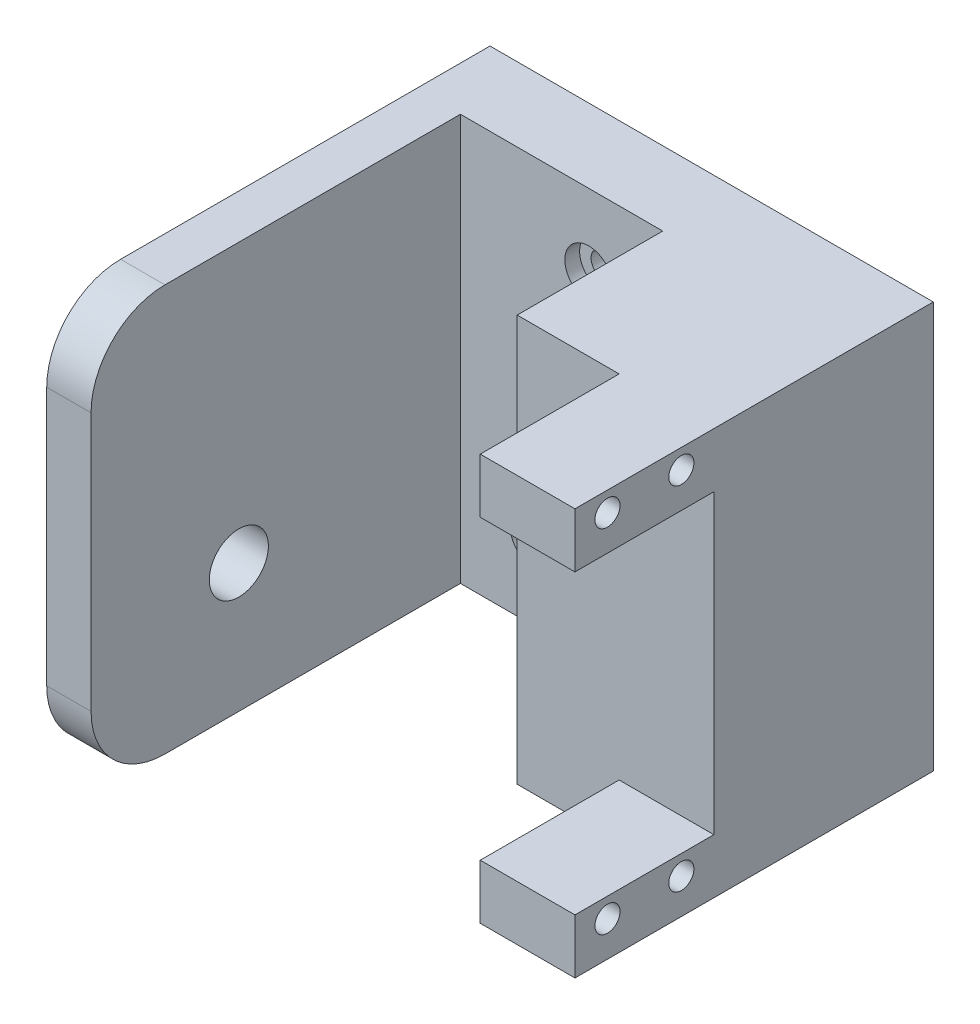
from build123d import *

# Parameters (mm, degrees)
ESQUISSE1_W                                          = 60
ESQUISSE1_H                                          = 55
BOSS_EXTRU_1_DEPTH                                   = 10
ESQUISSE2_W                                          = 6
ESQUISSE2_H                                          = 55
BOSS_EXTRU_2_DEPTH                                   = 50
ESQUISSE3_W                                          = 26.62
ESQUISSE3_H                                          = 55
BOSS_EXTRU_3_DEPTH                                   = 19.7
CHAMBRAGE_POUR_T_TE_CYLINDRIQUE_FENDUE_M_D           = 3.4
CHAMBRAGE_POUR_T_TE_CYLINDRIQUE_FENDUE_M_DEPTH       = 10
CHAMBRAGE_POUR_T_TE_CYLINDRIQUE_FENDUE_M_CBORE_D     = 6.5
CHAMBRAGE_POUR_T_TE_CYLINDRIQUE_FENDUE_M_CBORE_DEPTH = 2
CHAMBRAGE_POUR_T_TE_CYLINDRIQUE_FENDUE_M_TIP         = 1.021463052
CONG_1_R                                             = 10
ESQUISSE8_R                                          = 4
ENL_V_MAT_EXTRU_2_DEPTH                              = 6
ESQUISSE12_W                                         = 12.82
ESQUISSE12_H                                         = 7.4
BOSS_EXTRU_4_DEPTH                                   = 18.8
D_GAGEMENT_M32_D                                     = 3.4
D_GAGEMENT_M32_DEPTH                                 = 12.82
D_GAGEMENT_M32_TIP                                   = 1.021463052


with BuildPart() as part:
    # Esquisse1 → Boss.-Extru.1 (new body)
    with BuildSketch(Plane.XY):
        with Locations((30, 27.5)):
            Rectangle(ESQUISSE1_W, ESQUISSE1_H)
    extrude(amount=BOSS_EXTRU_1_DEPTH)

    # Esquisse2 → Boss.-Extru.2 (add)
    with BuildSketch(Plane.XY.offset(10)):
        with Locations((3, 27.5)):
            Rectangle(ESQUISSE2_W, ESQUISSE2_H)
    extrude(amount=BOSS_EXTRU_2_DEPTH)

    # Esquisse3 → Boss.-Extru.3 (add)
    with BuildSketch(Plane.XY.offset(10)):
        with Locations((46.69, 27.5)):
            Rectangle(ESQUISSE3_W, ESQUISSE3_H)
    extrude(amount=BOSS_EXTRU_3_DEPTH)

    # Chambrage pour tête cylindrique fendue M31
    with Locations(Plane.XY.offset(10)):
        with Locations((23.38, 45), (16, 10)):
            CounterBoreHole(CHAMBRAGE_POUR_T_TE_CYLINDRIQUE_FENDUE_M_D / 2, CHAMBRAGE_POUR_T_TE_CYLINDRIQUE_FENDUE_M_CBORE_D / 2, CHAMBRAGE_POUR_T_TE_CYLINDRIQUE_FENDUE_M_CBORE_DEPTH, depth=CHAMBRAGE_POUR_T_TE_CYLINDRIQUE_FENDUE_M_DEPTH)
            with Locations((0, 0, -(CHAMBRAGE_POUR_T_TE_CYLINDRIQUE_FENDUE_M_DEPTH + CHAMBRAGE_POUR_T_TE_CYLINDRIQUE_FENDUE_M_TIP / 2))):  # 118° drill point
                Cone(0, CHAMBRAGE_POUR_T_TE_CYLINDRIQUE_FENDUE_M_D / 2, CHAMBRAGE_POUR_T_TE_CYLINDRIQUE_FENDUE_M_TIP, mode=Mode.SUBTRACT)

    # Congé1
    cong_1_edges = [part.edges().sort_by_distance(p)[0] for p in [
        (3, 0, 60),
        (3, 55, 60),
    ]]
    fillet(cong_1_edges, radius=CONG_1_R)

    # Esquisse8 → Enlèv. mat.-Extru.2 (cut)
    with BuildSketch(Plane.ZY):
        with Locations((40, 17.4)):
            Circle(ESQUISSE8_R)
    extrude(amount=-ENL_V_MAT_EXTRU_2_DEPTH, mode=Mode.SUBTRACT)

    # Esquisse12 → Boss.-Extru.4 (add)
    with BuildSketch(Plane.XY.offset(29.7)):
        with Locations((53.59, 3.7)):
            Rectangle(ESQUISSE12_W, ESQUISSE12_H)
        with Locations((53.59, 51.3)):
            Rectangle(ESQUISSE12_W, ESQUISSE12_H)
    extrude(amount=BOSS_EXTRU_4_DEPTH)

    # Dégagement M32
    with Locations(Plane.ZY.offset(-47.18)):
        with Locations((44.1, 52.35), (34.1, 52.35), (44.1, 4.75), (34.1, 4.75)):
            Hole(D_GAGEMENT_M32_D / 2, depth=D_GAGEMENT_M32_DEPTH)
            with Locations((0, 0, -(D_GAGEMENT_M32_DEPTH + D_GAGEMENT_M32_TIP / 2))):  # 118° drill point
                Cone(0, D_GAGEMENT_M32_D / 2, D_GAGEMENT_M32_TIP, mode=Mode.SUBTRACT)


solid = part.part
